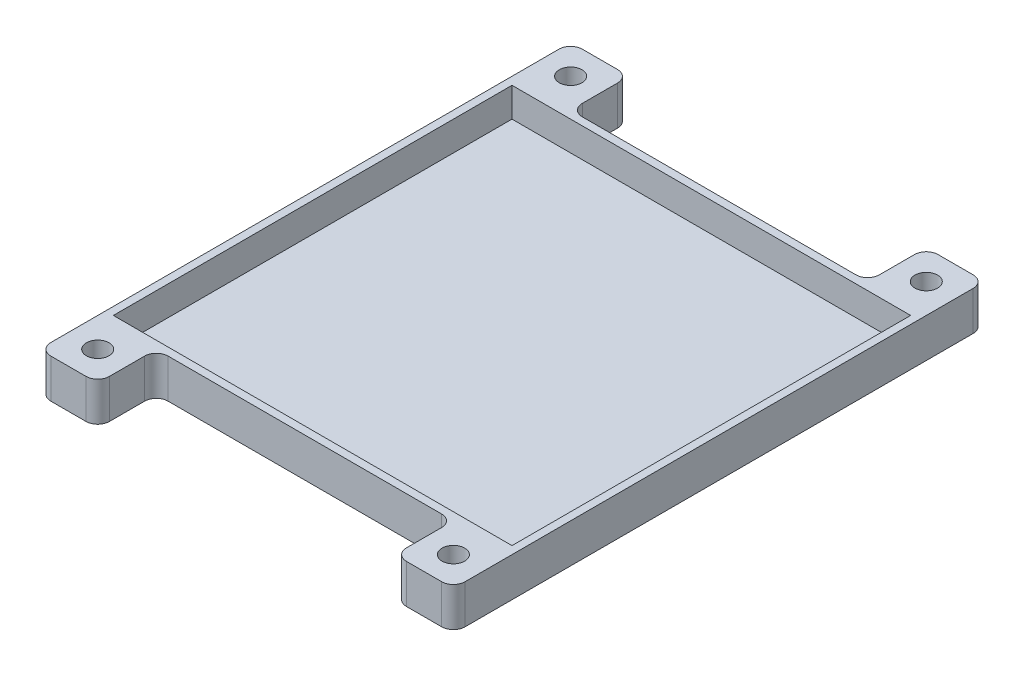
from build123d import *
from build123d.topology import SkipClean

# Parameters (mm, degrees)
SKETCH1_W            = 106
SKETCH1_H            = 106
BOSS_EXTRUDE1_DEPTH  = 8.5
SHELL1_T             = -2
BOSS_EXTRUDE2_START  = -2
SKETCH2_W            = 15
SKETCH2_H            = 15
BOSS_EXTRUDE2_DEPTH  = 8.5
M5_CLEARANCE_HOLE1_D = 5.8
SKETCH5_R            = 2.9
SKETCH5_W            = 102
SKETCH5_H            = 102
BOSS_EXTRUDE3_DEPTH  = 1.5
FILLET2_R            = 3
SKETCH6_W            = 102
SKETCH6_H            = 102
BOSS_EXTRUDE4_DEPTH  = 0.5


with BuildPart() as part:
    # Sketch1 → Boss-Extrude1 (new body)
    with BuildSketch(Plane(origin=(0, 0, 0), x_dir=(1, 0, 0), z_dir=(0, 1, 0))):
        Rectangle(SKETCH1_W, SKETCH1_H)
    extrude(amount=-BOSS_EXTRUDE1_DEPTH)

    # Shell1
    shell1_openings = [part.faces().sort_by_distance(p)[0] for p in [
        (0, 0, 0),
    ]]
    offset(amount=SHELL1_T, openings=shell1_openings, kind=Kind.INTERSECTION)

    # Sketch2 → Boss-Extrude2 (add)
    with BuildSketch(Plane(origin=(0, -6.5, 0), x_dir=(1, 0, 0), z_dir=(0, 1, 0)).offset(BOSS_EXTRUDE2_START)):
        with Locations((-45.5, 60.5)):
            Rectangle(SKETCH2_W, SKETCH2_H)
        with Locations((45.5, 60.5)):
            Rectangle(SKETCH2_W, SKETCH2_H)
        with Locations((45.5, -60.5)):
            Rectangle(SKETCH2_W, SKETCH2_H)
        with Locations((-45.5, -60.5)):
            Rectangle(SKETCH2_W, SKETCH2_H)
    extrude(amount=BOSS_EXTRUDE2_DEPTH)

    # M5 Clearance Hole1 (through all)
    with Locations(Plane(origin=(0, 0, 0), x_dir=(1, 0, 0), z_dir=(0, 1, 0))):
        with Locations((-45.5, -60.5), (-45.5, 60.5), (45.5, 60.5), (45.5, -60.5)):
            Hole(M5_CLEARANCE_HOLE1_D / 2)

    # Sketch5 → Boss-Extrude3 (add)
    with BuildSketch(Plane(origin=(0, 0, 0), x_dir=(1, 0, 0), z_dir=(0, 1, 0))):
        Polygon((53, -68), (53, 68), (38, 68), (38, 53), (-38, 53), (-38, 68), (-53, 68), (-53, -68), (-38, -68), (-38, -53), (38, -53), (38, -68), align=None)
        with Locations(Location((45.5, -60.5, 0), (0, 0, 270))):
            Circle(SKETCH5_R, mode=Mode.SUBTRACT)
        with Locations(Location((45.5, 60.5, 0), (0, 0, 270))):
            Circle(SKETCH5_R, mode=Mode.SUBTRACT)
        with Locations(Location((-45.5, 60.5, 0), (0, 0, 270))):
            Circle(SKETCH5_R, mode=Mode.SUBTRACT)
        with Locations(Location((-45.5, -60.5, 0), (0, 0, 270))):
            Circle(SKETCH5_R, mode=Mode.SUBTRACT)
        Rectangle(SKETCH5_W, SKETCH5_H, mode=Mode.SUBTRACT)
    extrude(amount=BOSS_EXTRUDE3_DEPTH)

    # Fillet2
    fillet2_edges = [part.edges().sort_by_distance(p)[0] for p in [
        (-53, -3.5, 68),
        (-38, -3.5, 53),
        (-38, -3.5, 68),
        (38, -3.5, 53),
        (53, -3.5, 68),
        (38, -3.5, 68),
        (53, -3.5, -68),
        (38, -3.5, -53),
        (38, -3.5, -68),
        (-53, -3.5, -68),
        (-38, -3.5, -68),
        (-38, -3.5, -53),
    ]]
    fillet(fillet2_edges, radius=FILLET2_R)

    # Sketch6 → Boss-Extrude4 (add)
    with SkipClean():  # the faces are left unmerged after this step: merging them gives an invalid solid
        with BuildSketch(Plane(origin=(0, -6.5, 0), x_dir=(1, 0, 0), z_dir=(0, 1, 0))):
            Rectangle(SKETCH6_W, SKETCH6_H)
        extrude(amount=BOSS_EXTRUDE4_DEPTH)


solid = part.part
